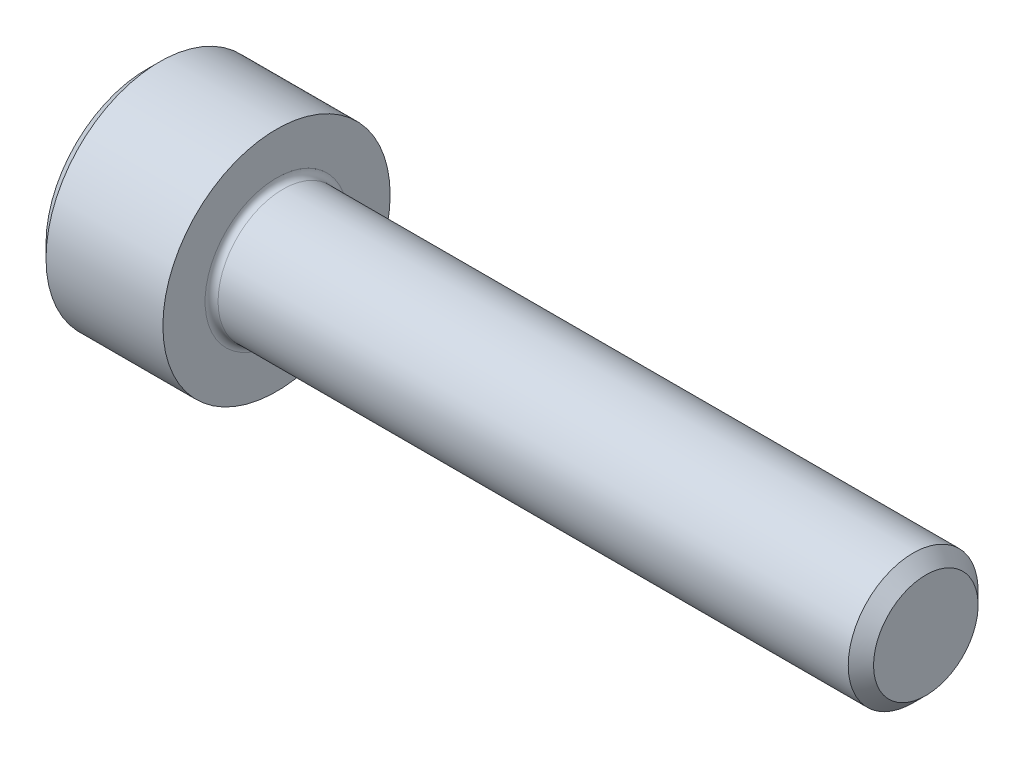
from build123d import *

# Parameters (mm, degrees)
FILLET1_R   = 0.2
HEX_2_DEPTH = 2


with BuildPart() as part:
    # BodySke → Base-Revolve (revolve)
    with BuildSketch(Plane.XY, mode=Mode.PRIVATE) as base_revolve_sk:
        Polygon((0, 0), (0, 3.1), (0.4, 3.5), (4, 3.5), (4, 2), (23.61, 2), (24, 1.61), (24, 0), align=None)
    revolve(base_revolve_sk.sketch.rotate(Axis((-31.75, 0, 0), (1, 0, 0)), 90), axis=Axis((-31.75, 0, 0), (1, 0, 0)))

    # Fillet1
    fillet1_edges = [part.edges().sort_by_distance(p)[0] for p in [
        (4, 0, -2),
    ]]
    fillet(fillet1_edges, radius=FILLET1_R)

    # Sketch2 → Hex-PreBroach (revolve, cut)
    with BuildSketch(Plane.XY, mode=Mode.PRIVATE) as hex_prebroach_sk:
        Polygon((0, 1.5355), (2, 1.5355), (2.886521338, 0), (0, 0), align=None)
    revolve(hex_prebroach_sk.sketch.rotate(Axis((0, 0, 0), (1, 0, 0)), 90), axis=Axis((0, 0, 0), (1, 0, 0)), mode=Mode.SUBTRACT)

    # Sketch3 → Hex 2 (cut)
    with BuildSketch(Plane(origin=(0, 0, 0), x_dir=(0, 0.500000000000001, 0.866025403784438), z_dir=(-1, 0, 0))):
        Polygon((0.886521338, 1.5355), (-0.886521338, 1.5355), (-1.773042677, 0), (-0.886521338, -1.5355), (0.886521338, -1.5355), (1.773042677, 0), align=None)
    extrude(amount=-HEX_2_DEPTH, mode=Mode.SUBTRACT)


solid = part.part
